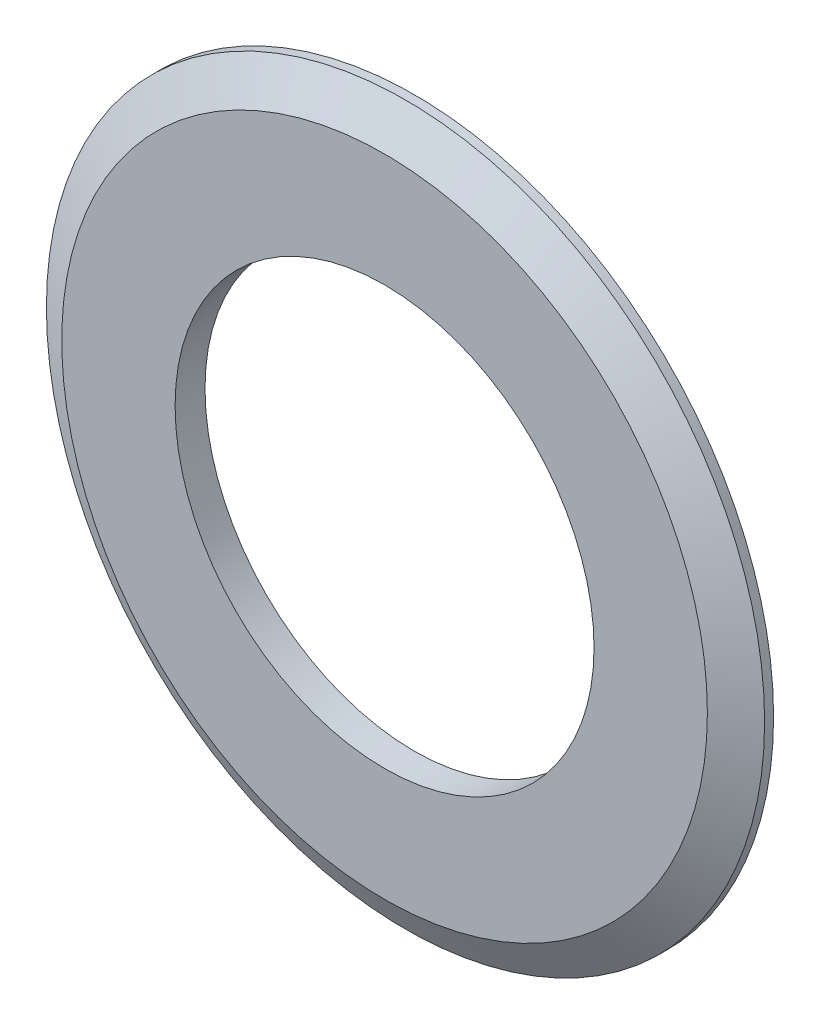
from build123d import *

# Parameters (mm, degrees)
SKETCH1_R           = 12
BOSS_EXTRUDE1_DEPTH = 1
SKETCH2_R           = 7
CUT_EXTRUDE1_DEPTH  = 1
CHAMFER1_SIZE       = 0.7
CHAMFER1_SIZE2      = 1.212435565


with BuildPart() as part:
    # Sketch1 → Boss-Extrude1 (new body)
    with BuildSketch(Plane.XY):
        Circle(SKETCH1_R)
    extrude(amount=BOSS_EXTRUDE1_DEPTH)

    # Sketch2 → Cut-Extrude1 (cut)
    with BuildSketch(Plane.XY.offset(1)):
        Circle(SKETCH2_R)
    extrude(amount=-CUT_EXTRUDE1_DEPTH, mode=Mode.SUBTRACT)

    # Chamfer1
    chamfer1_edges = [part.edges().sort_by_distance(p)[0] for p in [
        (-12, 0, 1),
    ]]
    chamfer1_side = [part.faces().sort_by_distance(p)[0] for p in [
        (-12, 0, 0.5),
    ]]
    chamfer(chamfer1_edges, length=CHAMFER1_SIZE, length2=CHAMFER1_SIZE2, reference=chamfer1_side[0])


solid = part.part
